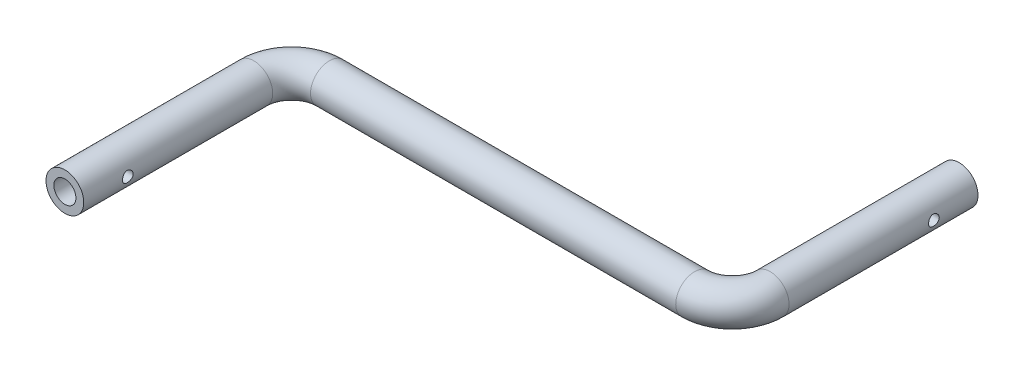
from build123d import *

# Parameters (mm, degrees)
SKETCH2_R          = 15
SKETCH2_R_2        = 8.75
M10_TAPPED_HOLE1_D = 8.5
M10_TAPPED_HOLE2_D = 8.5


with BuildPart() as part:
    # Sweep1: sweep along a path in Sketch1
    with BuildLine(Plane(origin=(0, 0, 0), x_dir=(1, 0, 0), z_dir=(0, 1, 0))) as sweep1_path:
        Line((175, 180), (175, 30))
        ThreePointArc((175, 30), (166.213203436, 8.786796564), (145, 0))
        Line((145, 0), (-145, 0))
        ThreePointArc((-145, 0), (-166.213203436, -8.786796564), (-175, -30))
        Line((-175, -30), (-175, -180))
    # Sketch2 → Sweep1 (sweep)
    with BuildSketch(Plane(origin=(0, 0, 0), x_dir=(0, 0, -1), z_dir=(1, 0, 0))):
        Circle(SKETCH2_R)
        Circle(SKETCH2_R_2, mode=Mode.SUBTRACT)
    sweep(path=sweep1_path.line)

    # M10 Tapped Hole1 (through all)
    with Locations(Plane(origin=(-190, 0, 145), x_dir=(0, -1, 0), z_dir=(-1, 0, 0))):
        with Locations((0, 0)):
            Hole(M10_TAPPED_HOLE1_D / 2)

    # M10 Tapped Hole2 (through all)
    with Locations(Plane(origin=(190, 0, -145), x_dir=(0, 0, 1), z_dir=(1, 0, 0))):
        with Locations((0, 0)):
            Hole(M10_TAPPED_HOLE2_D / 2)


solid = part.part
